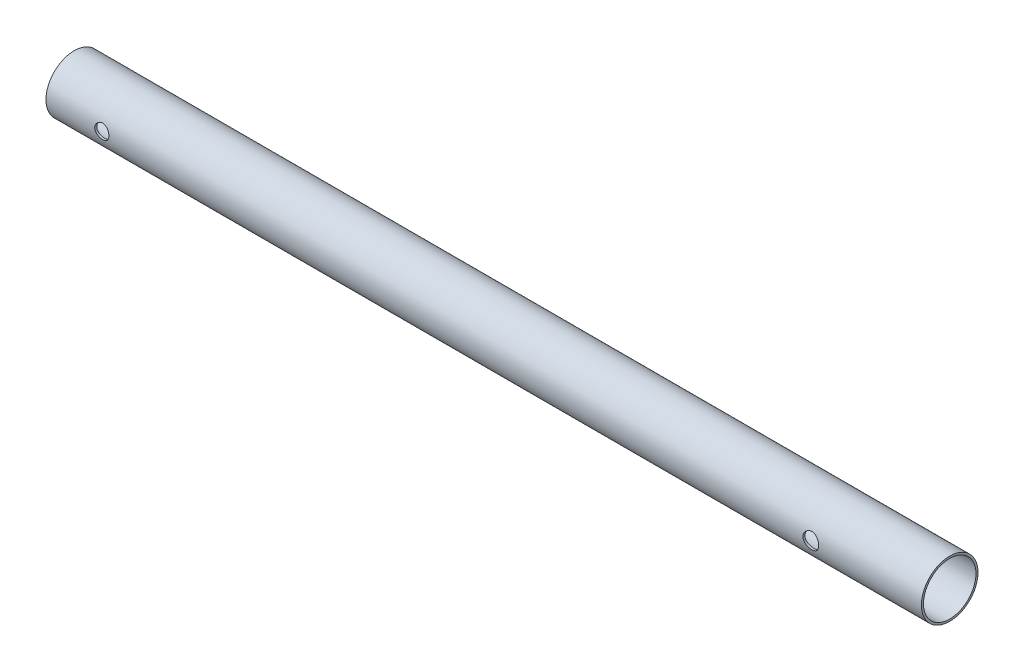
from build123d import *

# Parameters (mm, degrees)
SKETCH1_R               = 11
SKETCH1_R_2             = 10.2
BOSS_EXTRUDE1_DEPTH     = 340.279
CUT_EXTRUDE1_DEPTH      = 378.64
CUT_EXTRUDE1_DEPTH_BACK = 378.64
SKETCH2_R               = 2.756225819
SKETCH2_R_2             = 3.066881292


with BuildPart() as part:
    # Sketch1 → Boss-Extrude1 (new body)
    with BuildSketch(Plane(origin=(0, 0, 0), x_dir=(0, 0, -1), z_dir=(1, 0, 0))):
        Circle(SKETCH1_R)
        Circle(SKETCH1_R_2, mode=Mode.SUBTRACT)
    extrude(amount=BOSS_EXTRUDE1_DEPTH)

    # Sketch2 → Cut-Extrude1 (cut, two sides: drawn at the far end of the back side and taken through both)
    with BuildSketch(Plane.XY.offset(-CUT_EXTRUDE1_DEPTH_BACK)):
        with Locations((21.71, 0)):
            Circle(SKETCH2_R)
        with Locations((297.279, 0)):
            Circle(SKETCH2_R_2)
    extrude(amount=CUT_EXTRUDE1_DEPTH + CUT_EXTRUDE1_DEPTH_BACK, mode=Mode.SUBTRACT)


solid = part.part
